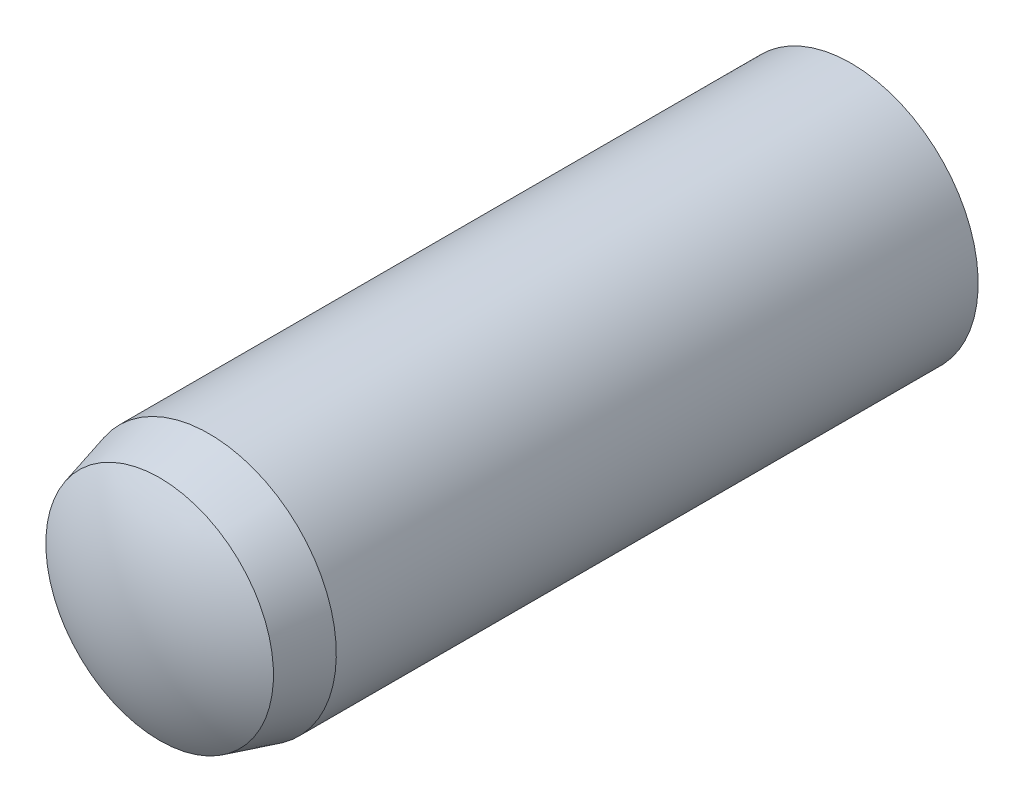
from build123d import *


with BuildPart() as part:
    # Sketch3 → Revolve1 (revolve)
    with BuildSketch(Plane(origin=(0, 0, 0), x_dir=(0, 0, -1), z_dir=(1, 0, 0))):
        with BuildLine():
            Line((-12, 0), (12, 0))
            ThreePointArc((12, 0), (11.693537673, 2.088061302), (10.8, 4))
            Line((10.8, 4), (-9.4, 4))
            Line((-9.4, 4), (-10.96, 3.58199926))
            ThreePointArc((-10.96, 3.58199926), (-11.734740106, 1.864961038), (-12, 0))
        make_face()
    revolve(axis=Axis((0, 0, 12), (0, 0, -1)))


solid = part.part
